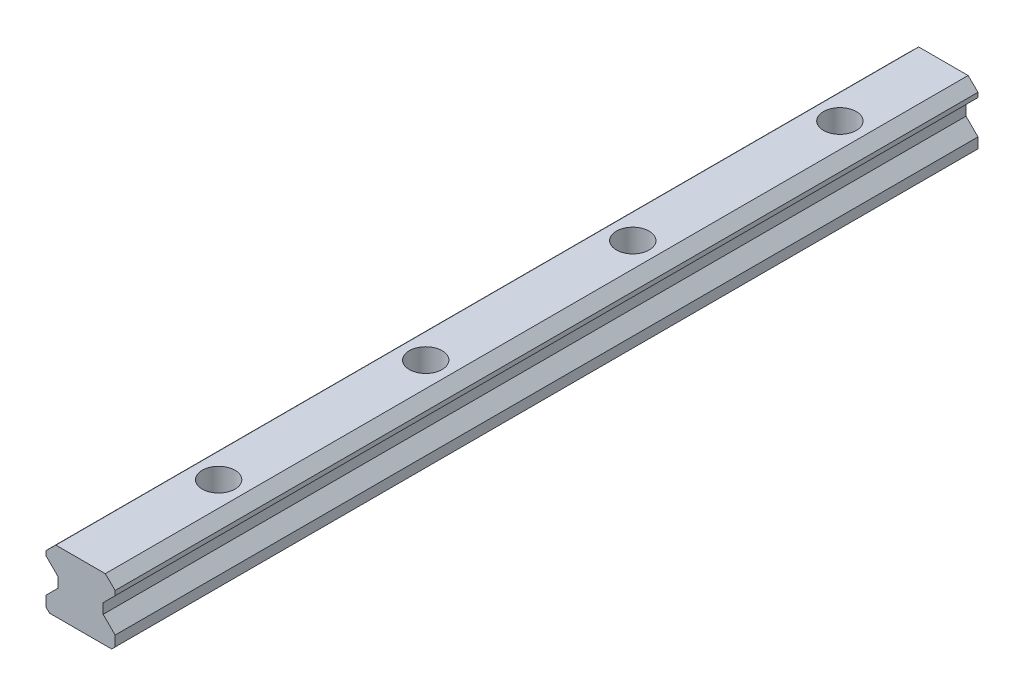
from build123d import *

# Parameters (mm, degrees)
BOSS_EXTRUDE1_DEPTH = 250
LPATTERN2_COUNT     = 4
LPATTERN2_PITCH     = 60


with BuildPart() as part:
    # Sketch1 → Boss-Extrude1 (new body)
    with BuildSketch(Plane.XY):
        Polygon((0, 18), (0, 0), (9, 0), (10.018233765, 1.018233765), (10.018233765, 4.018233765), (6.55, 7.48646753), (6.55, 10.41646753), (10.018233765, 13.884701295), (10.018233765, 15.214701295), (7.16, 18), align=None)
        Polygon((-9, 0), (0, 0), (0, 18), (-7.16, 18), (-10.018233765, 15.214701295), (-10.018233765, 13.884701295), (-6.55, 10.41646753), (-6.55, 7.48646753), (-10.018233765, 4.018233765), (-10.018233765, 1.018233765), align=None)
    extrude(amount=BOSS_EXTRUDE1_DEPTH)

    # Sketch4 → Hole1 (revolve, cut)
    with BuildSketch(Plane(origin=(0, 18, 30), x_dir=(0, 0, 1), z_dir=(1, 0, 0))):
        Polygon((0, 0), (0, 19.652366702), (2.75, 18), (2.75, 8.5), (4.75, 8.5), (4.75, 0), align=None)
    hole1 = revolve(axis=Axis((0, 29.310875039, 30), (0, -1, 0)), mode=Mode.SUBTRACT)

    # LPattern2: Hole1 ×4
    with Locations(*[(0, 0, i * LPATTERN2_PITCH) for i in range(1, LPATTERN2_COUNT)]):
        add(hole1, mode=Mode.SUBTRACT)


solid = part.part
